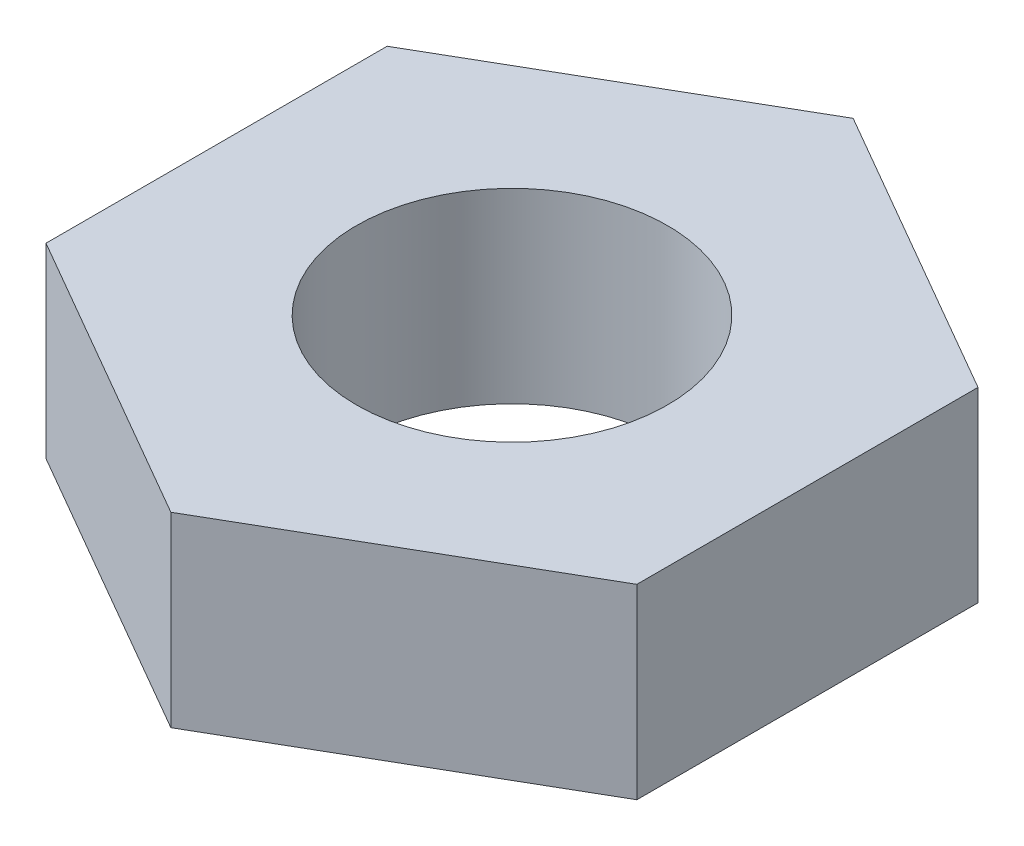
from build123d import *

# Parameters (mm, degrees)
CROQUIS1_R              = 2.5
SALIENTE_EXTRUIR1_DEPTH = 3


with BuildPart() as part:
    # Croquis1 → Saliente-Extruir1 (new body)
    with BuildSketch(Plane(origin=(0, 0, 0), x_dir=(1, 0, 0), z_dir=(0, 1, 0))):
        Polygon((0, 5.484827557), (-4.75, 2.742413779), (-4.75, -2.742413779), (0, -5.484827557), (4.75, -2.742413779), (4.75, 2.742413779), align=None)
        with Locations(Location((0, 0, 0), (0, 0, 270))):
            Circle(CROQUIS1_R, mode=Mode.SUBTRACT)
    extrude(amount=SALIENTE_EXTRUIR1_DEPTH)


solid = part.part
